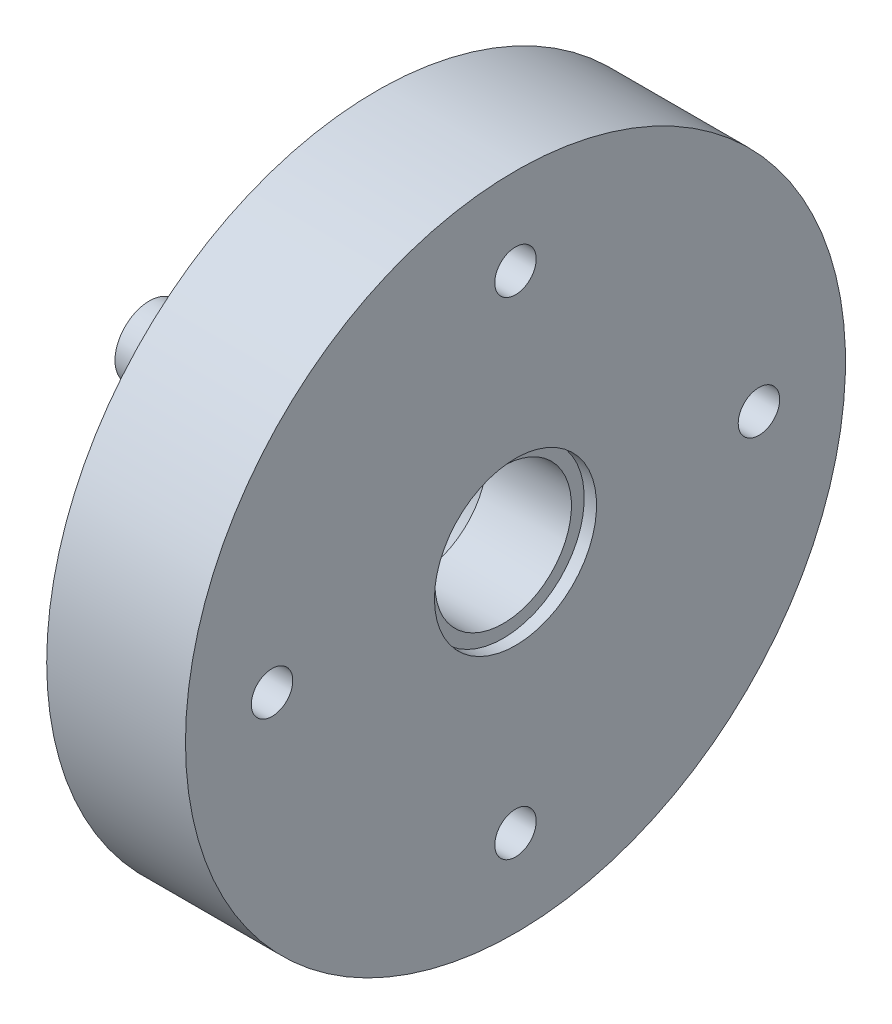
from build123d import *

# Parameters (mm, degrees)
CBORE_FOR_M3_HEX_SOCKET_HEAD_CAP_SCR_2_COUNT = 2
CBORE_FOR_M3_HEX_SOCKET_HEAD_CAP_SCR_2_PITCH = 28.243387552
CBORE_FOR_M3_HEX_SOCKET_HEAD_CAP_SCR_3_COUNT = 2
CBORE_FOR_M3_HEX_SOCKET_HEAD_CAP_SCR_3_PITCH = 39.942181723
CBORE_FOR_M3_HEX_SOCKET_HEAD_CAP_SCR_4_COUNT = 2
CBORE_FOR_M3_HEX_SOCKET_HEAD_CAP_SCR_4_PITCH = 28.243387552


with BuildPart() as part:
    # Sketch1 → Revolve17 (revolve)
    with BuildSketch(Plane.XY, mode=Mode.PRIVATE) as revolve17_sk:
        Polygon((-71.291859268, 14.884170222), (-71.291859268, 14.534170222), (-66.841859268, 14.884170222), (-66.841859268, 14.534170222), (-62.371609448, 14.884170222), (-62.371609448, 14.534170222), (-59.488918076, 23.788045652), (-57.091214807, 23.788045652), (-57.091214807, 38.788045652), (-45.705811648, 38.788045652), (-45.705811648, 19.977485582), (-45.705811648, 18.364170222), (-46.715811648, 18.364170222), (-46.715811648, 17.314170222), (-53.637545484, 17.314170222), (-59.488918076, 13.399170222), (-75.741859268, 13.399170222), (-75.741859268, 14.534170222), align=None)
    revolve(revolve17_sk.sketch.rotate(Axis((-795.163849313, 11.714170222, 0), (1, 0, 0)), 90), axis=Axis((-795.163849313, 11.714170222, 0), (1, 0, 0)))

    # Sketch4 → CBORE for M3 Hex Socket Head Cap Screw1 (revolve, cut)
    with BuildSketch(Plane(origin=(-57.091214807, 11.714170222, -19.971090862), x_dir=(0, 0, 1), z_dir=(0, 1, 0))):
        Polygon((0, 0), (0, 11.385403159), (1.7, 11.385403159), (1.7, 3.4), (3.25, 3.4), (3.25, 0.025), (3.275, 0), align=None)
    cbore_for_m3_hex_socket_head_cap_screw1 = revolve(axis=Axis((-63.441214807, 11.714170222, -19.971090862), (1, 0, 0)), mode=Mode.SUBTRACT)

    # CBORE for M3 Hex Socket Head Cap Scr 2: CBORE for M3 Hex Socket Head Cap Screw1 ×2
    with Locations(*[Vector(0, 0.7071067811865475, 0.7071067811865476) * (i * CBORE_FOR_M3_HEX_SOCKET_HEAD_CAP_SCR_2_PITCH) for i in range(1, CBORE_FOR_M3_HEX_SOCKET_HEAD_CAP_SCR_2_COUNT)]):
        add(cbore_for_m3_hex_socket_head_cap_screw1, mode=Mode.SUBTRACT)

    # CBORE for M3 Hex Socket Head Cap Scr 3: CBORE for M3 Hex Socket Head Cap Screw1 ×2
    with Locations(*[(0, 0, i * CBORE_FOR_M3_HEX_SOCKET_HEAD_CAP_SCR_3_PITCH) for i in range(1, CBORE_FOR_M3_HEX_SOCKET_HEAD_CAP_SCR_3_COUNT)]):
        add(cbore_for_m3_hex_socket_head_cap_screw1, mode=Mode.SUBTRACT)

    # CBORE for M3 Hex Socket Head Cap Scr 4: CBORE for M3 Hex Socket Head Cap Screw1 ×2
    with Locations(*[Vector(0, -0.7071067811865476, 0.7071067811865475) * (i * CBORE_FOR_M3_HEX_SOCKET_HEAD_CAP_SCR_4_PITCH) for i in range(1, CBORE_FOR_M3_HEX_SOCKET_HEAD_CAP_SCR_4_COUNT)]):
        add(cbore_for_m3_hex_socket_head_cap_screw1, mode=Mode.SUBTRACT)


solid = part.part
